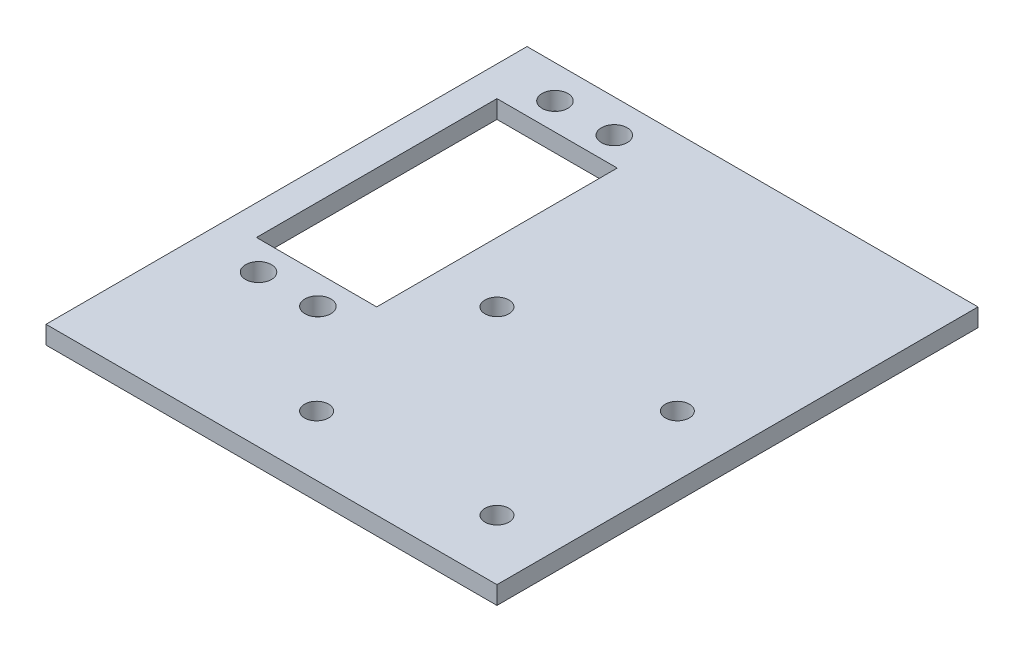
from build123d import *

# Parameters (mm, degrees)
SKETCH2_W           = 80
SKETCH2_H           = 80
BOSS_EXTRUDE1_DEPTH = 3
SKETCH3_R           = 2.15
SKETCH3_W           = 20
SKETCH3_H           = 40
CUT_EXTRUDE1_DEPTH  = 3
SKETCH4_W           = 5
SKETCH4_H           = 80
CUT_EXTRUDE2_DEPTH  = 10
SKETCH5_R           = 2
CUT_EXTRUDE3_DEPTH  = 10


with BuildPart() as part:
    # Sketch2 → Boss-Extrude1 (new body)
    with BuildSketch(Plane(origin=(0, 0, 0), x_dir=(1, 0, 0), z_dir=(0, 1, 0))):
        Rectangle(SKETCH2_W, SKETCH2_H)
    extrude(amount=BOSS_EXTRUDE1_DEPTH)

    # Sketch3 → Cut-Extrude1 (cut)
    with BuildSketch(Plane(origin=(0, 3, 0), x_dir=(1, 0, 0), z_dir=(0, 1, 0))):
        with Locations(Location((-29.845, 34.49, 0), (0, 0, 270))):
            Circle(SKETCH3_R)
        with Locations(Location((-19.975, 34.49, 0), (0, 0, 270))):
            Circle(SKETCH3_R)
        with Locations(Location((-19.975, -14.81, 0), (0, 0, 270))):
            Circle(SKETCH3_R)
        with Locations(Location((-29.845, -14.81, 0), (0, 0, 270))):
            Circle(SKETCH3_R)
        with Locations((-25, 10)):
            Rectangle(SKETCH3_W, SKETCH3_H)
    extrude(amount=-CUT_EXTRUDE1_DEPTH, mode=Mode.SUBTRACT)

    # Sketch4 → Cut-Extrude2 (cut)
    with BuildSketch(Plane(origin=(0, 3, 0), x_dir=(1, 0, 0), z_dir=(0, 1, 0))):
        with Locations((37.5, 0)):
            Rectangle(SKETCH4_W, SKETCH4_H)
    extrude(amount=-CUT_EXTRUDE2_DEPTH, mode=Mode.SUBTRACT)

    # Sketch5 → Cut-Extrude3 (cut)
    with BuildSketch(Plane.XZ):
        with Locations(Location((25, 0, 0), (0, 0, 270))):
            Circle(SKETCH5_R)
        with Locations(Location((-5, 0, 0), (0, 0, 270))):
            Circle(SKETCH5_R)
        with Locations(Location((-5, 30, 0), (0, 0, 270))):
            Circle(SKETCH5_R)
        with Locations(Location((25, 30, 0), (0, 0, 270))):
            Circle(SKETCH5_R)
    extrude(amount=-CUT_EXTRUDE3_DEPTH, mode=Mode.SUBTRACT)


solid = part.part
